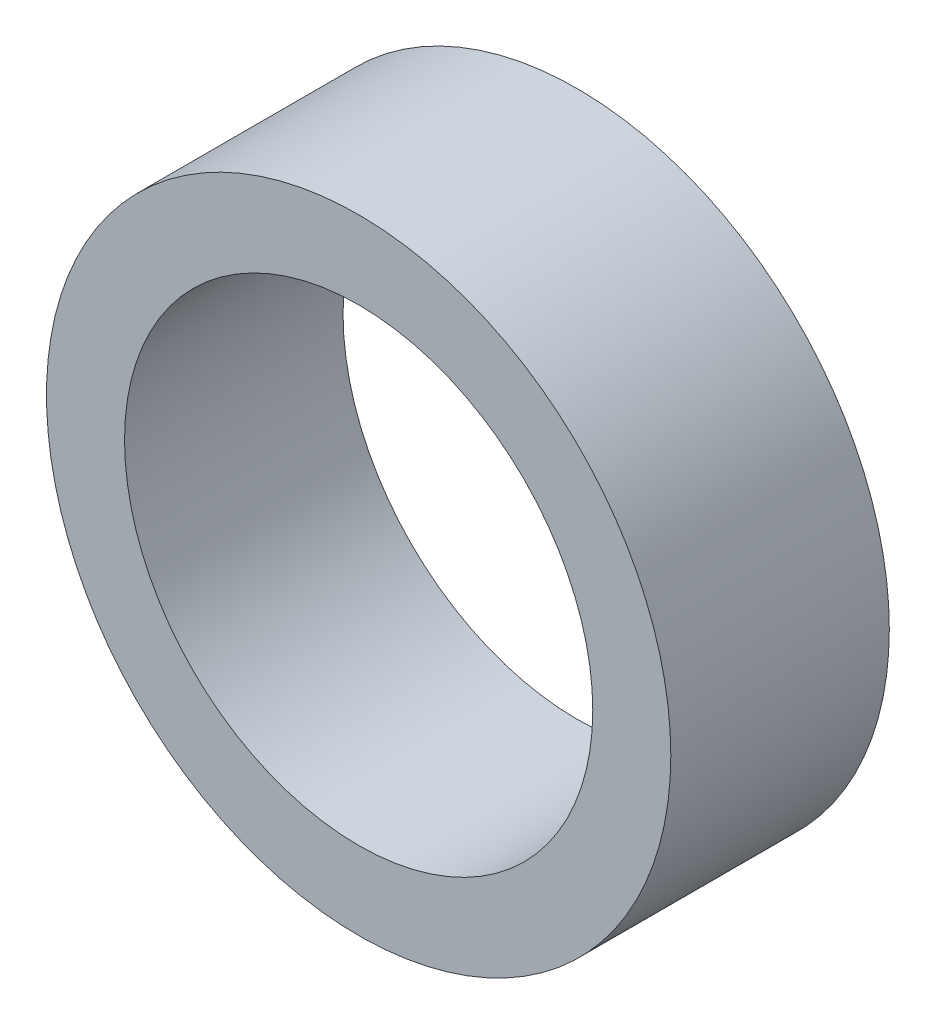
from build123d import *

# Parameters (mm, degrees)
SKETCH1_R           = 4
SKETCH1_R_2         = 3
BOSS_EXTRUDE1_DEPTH = 2.8


with BuildPart() as part:
    # Sketch1 → Boss-Extrude1 (new body)
    with BuildSketch(Plane.XY):
        with Locations((-20, -10)):
            Circle(SKETCH1_R)
        with Locations((-20, -10)):
            Circle(SKETCH1_R_2, mode=Mode.SUBTRACT)
    extrude(amount=BOSS_EXTRUDE1_DEPTH)


solid = part.part
